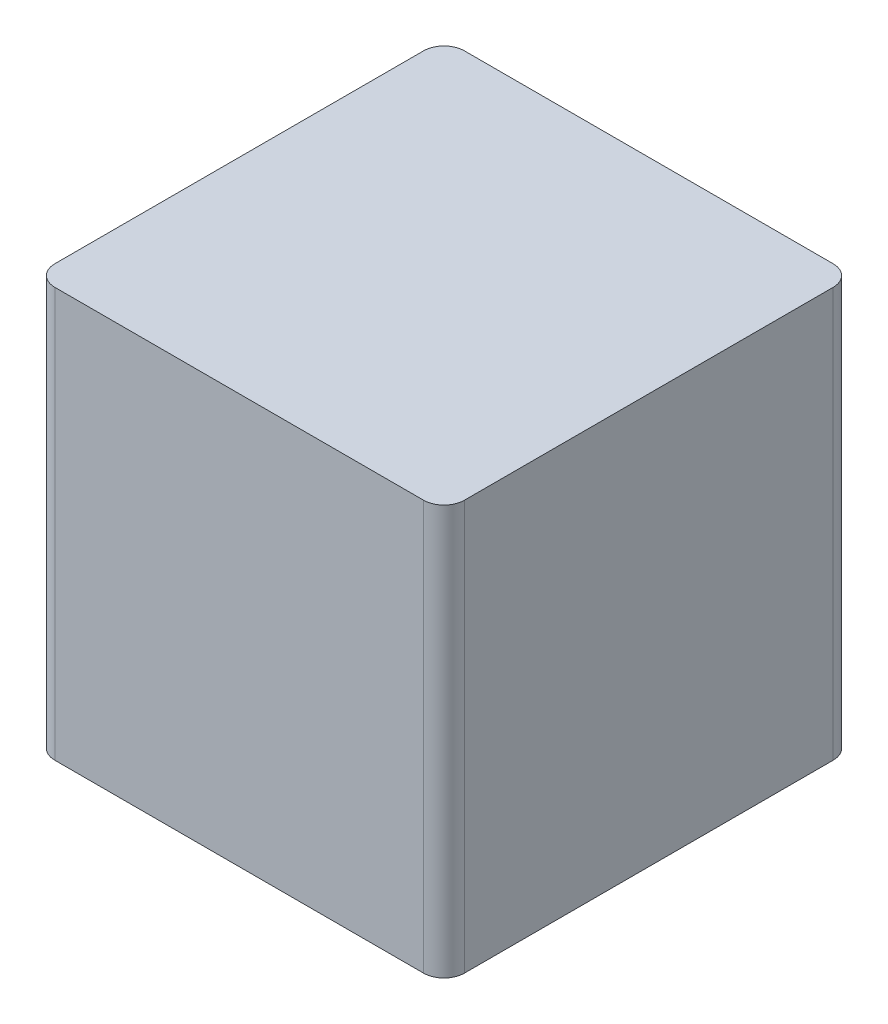
from build123d import *

# Parameters (mm, degrees)
SKETCH1_W           = 20
SKETCH1_H           = 20
BOSS_EXTRUDE1_DEPTH = 20
FILLET1_R           = 1


with BuildPart() as part:
    # Sketch1 → Boss-Extrude1 (new body)
    with BuildSketch(Plane(origin=(0, 0, 0), x_dir=(1, 0, 0), z_dir=(0, 1, 0))):
        Rectangle(SKETCH1_W, SKETCH1_H)
    extrude(amount=BOSS_EXTRUDE1_DEPTH)

    # Fillet1
    fillet1_edges = [part.edges().sort_by_distance(p)[0] for p in [
        (10, 10, 10),
        (-10, 10, 10),
        (-10, 10, -10),
        (10, 10, -10),
    ]]
    fillet(fillet1_edges, radius=FILLET1_R)


solid = part.part
